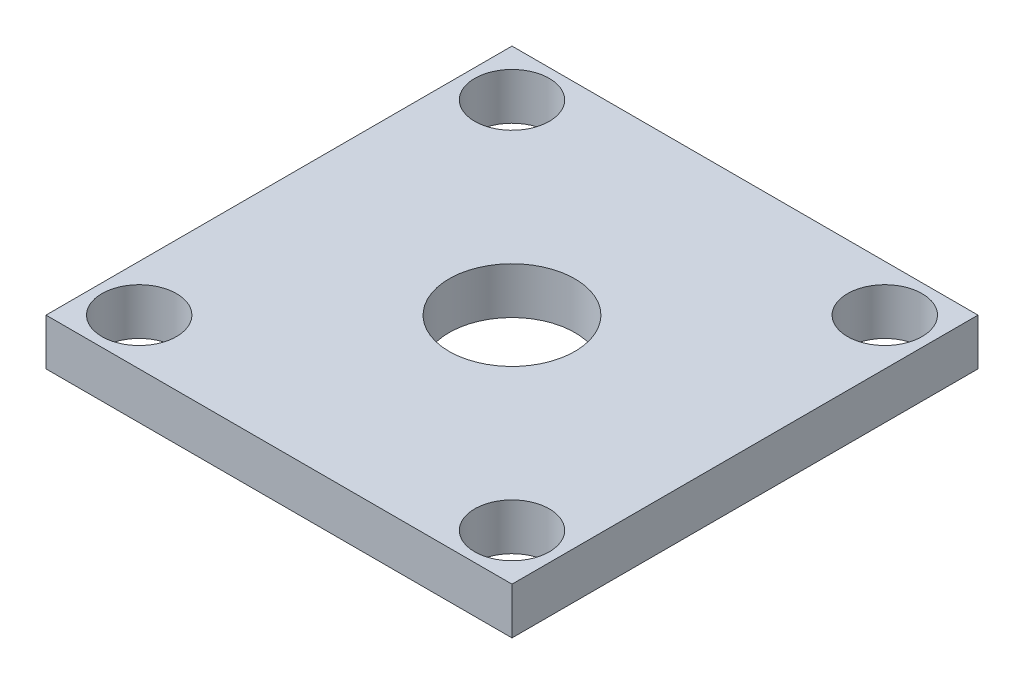
from build123d import *

# Parameters (mm, degrees)
SKETCH_1_W      = 10
SKETCH_1_H      = 10
SKETCH_1_R      = 1.35
SKETCH_1_R_2    = 0.8
EXTRUDE_1_DEPTH = 1


with BuildPart() as part:
    # 草图1 → 凸台-拉伸1 (new body)
    with BuildSketch(Plane(origin=(0, 0, 0), x_dir=(1, 0, 0), z_dir=(0, 1, 0))):
        Rectangle(SKETCH_1_W, SKETCH_1_H)
        with Locations(Location((0, 0, 0), (0, 0, 270))):
            Circle(SKETCH_1_R, mode=Mode.SUBTRACT)
        with Locations(Location((-4, 4, 0), (0, 0, 270))):
            Circle(SKETCH_1_R_2, mode=Mode.SUBTRACT)
        with Locations(Location((4, -4, 0), (0, 0, 270))):
            Circle(SKETCH_1_R_2, mode=Mode.SUBTRACT)
        with Locations(Location((4, 4, 0), (0, 0, 270))):
            Circle(SKETCH_1_R_2, mode=Mode.SUBTRACT)
        with Locations(Location((-4, -4, 0), (0, 0, 270))):
            Circle(SKETCH_1_R_2, mode=Mode.SUBTRACT)
    extrude(amount=EXTRUDE_1_DEPTH)


solid = part.part
